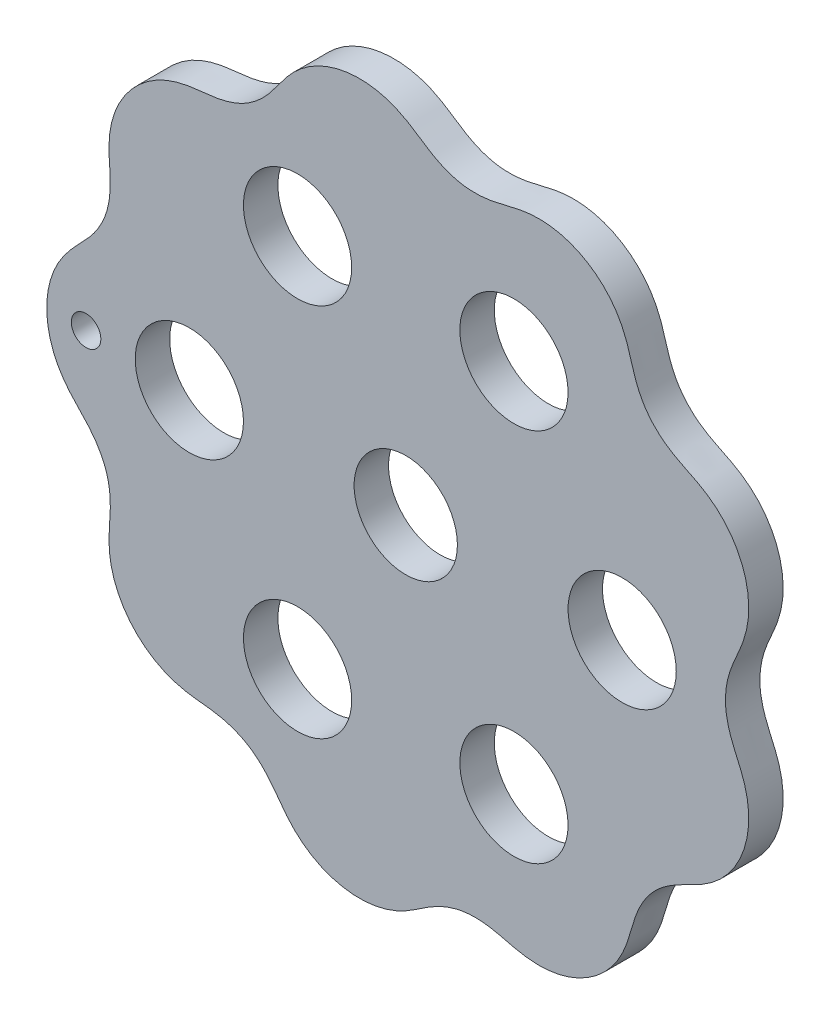
from build123d import *

# Parameters (mm, degrees)
BOSS_EXTRUDE1_DEPTH = 7
SKETCH2_R           = 11
CUT_EXTRUDE1_DEPTH  = 103.897295537
SKETCH3_R           = 10.5
CUT_EXTRUDE2_DEPTH  = 103.897295537
SKETCH4_R           = 3
CUT_EXTRUDE3_DEPTH  = 103.897295537


with BuildPart() as part:
    # Sketch1 → Boss-Extrude1 (new body)
    with BuildSketch(Plane.XY):
        with BuildLine():
            add(Edge.make_bspline(
                [(64.999997419, 0.000806947), (65.00000609, 0.21013312), (65.007534948, 0.64054093), (65.042332664, 1.291380489), (65.135594495, 2.159460023), (65.277248851, 3.032680008), (65.493830203, 4.038569318), (65.809087942, 5.168293211), (66.3609477, 6.758386753), (67.195560637, 8.680353986), (68.186353458, 10.826517495), (69.006376801, 13.131037551), (69.49208346, 15.232893556), (69.778704141, 17.621751772), (69.758565384, 20.283615304), (69.242050418, 23.384282514), (67.989755767, 26.780516545), (66.100351811, 29.905060607), (63.985642903, 32.22443192), (61.963179868, 33.833106887), (59.924357249, 35.117342135), (58.002602637, 36.111433425), (55.773019988, 37.145335072), (53.157717558, 38.627233325), (50.663432719, 40.61244418), (48.177244341, 43.633158774), (46.549449378, 47.248622642), (45.678840997, 50.853036944), (44.487714221, 54.371357413), (42.978225844, 57.263635788), (40.837389165, 60.000224897), (38.049129423, 62.402846227), (34.85625957, 64.226264819), (31.374996628, 65.405595202), (27.906716495, 65.863536097), (24.590928635, 65.686380175), (21.60649148, 65.05079625), (18.916301522, 64.32307683), (15.998824641, 63.774192759), (12.847584732, 63.668028743), (9.728816556, 64.215195529), (6.802016032, 65.388148141), (4.246370247, 66.898838322), (1.967008792, 68.502393598), (-0.618218868, 70.123158088), (-3.671586225, 71.428030238), (-7.086254723, 72.188828978), (-10.76079625, 72.276450148), (-14.385647807, 71.660073729), (-17.829274613, 70.360829533), (-20.779679678, 68.525713643), (-23.190373511, 66.327558714), (-25.516643206, 63.431388327), (-27.565898104, 60.341268628), (-30.327307182, 57.496189029), (-33.693402094, 55.502540068), (-36.714668658, 54.4848558), (-39.309815704, 54.046474509), (-41.383983168, 53.836930402), (-43.161911331, 53.642278824), (-44.638619491, 53.420081839), (-46.62901432, 52.992886762), (-49.081018776, 52.175907503), (-51.863431912, 50.724039888), (-54.737535189, 48.416484059), (-57.117755121, 45.598389652), (-58.915184236, 42.372849822), (-59.987505481, 39.048729025), (-60.406669899, 35.790711752), (-60.325551079, 32.752234211), (-60.072329686, 29.966065889), (-60.013760517, 26.959013226), (-60.450787322, 23.76610463), (-61.549631637, 20.723753194), (-63.253776488, 17.988179386), (-64.989814093, 15.987160092), (-66.447032939, 14.499376804), (-67.657205891, 13.224642472), (-68.599672039, 12.146432903), (-69.536773989, 10.932049653), (-70.432812405, 9.563522537), (-71.249982649, 8.029694321), (-71.950438385, 6.329058177), (-72.480134133, 4.567748418), (-72.835401264, 2.763237252), (-72.969755125, 1.387355273), (-72.999876295, 0.466180194), (-72.999999894, 0.004048412), (-73.000000052, 0.000971906), (-73.000000061, 0.000809922), (-73.000000067, 0.000647937), (-73.000000077, 0.000323969), (-73.000000078, 0), (-73.000000077, -0.000323969), (-73.000000067, -0.000647937), (-73.000000061, -0.000809922), (-73.000000052, -0.000971906), (-72.999999894, -0.004048412), (-72.999876295, -0.466180194), (-72.969755125, -1.387355273), (-72.835401264, -2.763237252), (-72.480134133, -4.567748418), (-71.950438385, -6.329058177), (-71.249982649, -8.029694321), (-70.432812405, -9.563522537), (-69.536773989, -10.932049653), (-68.599672039, -12.146432903), (-67.657205891, -13.224642472), (-66.447032939, -14.499376804), (-64.989814093, -15.987160092), (-63.253776488, -17.988179386), (-61.549631637, -20.723753194), (-60.450787322, -23.76610463), (-60.013760517, -26.959013226), (-60.072329686, -29.966065889), (-60.325551079, -32.752234211), (-60.406669899, -35.790711752), (-59.987505481, -39.048729025), (-58.915184237, -42.372849822), (-57.117755121, -45.598389652), (-54.737535189, -48.416484059), (-51.863431912, -50.724039888), (-49.081018776, -52.175907503), (-46.62901432, -52.992886762), (-44.638619491, -53.420081839), (-43.161911332, -53.642278824), (-41.383983168, -53.836930402), (-39.309815704, -54.046474509), (-36.714668658, -54.4848558), (-33.693402094, -55.502540068), (-30.327307182, -57.496189029), (-27.565898104, -60.341268628), (-25.516643206, -63.431388327), (-23.190373511, -66.327558714), (-20.779679678, -68.525713643), (-17.829274613, -70.360829533), (-14.385647807, -71.660073729), (-10.76079625, -72.276450148), (-7.086254723, -72.188828978), (-3.671586225, -71.428030238), (-0.618218868, -70.123158088), (1.967008792, -68.502393598), (4.246370247, -66.898838322), (6.802016032, -65.388148141), (9.728816556, -64.215195529), (12.847584732, -63.668028743), (15.998824641, -63.774192759), (18.916301522, -64.32307683), (21.60649148, -65.05079625), (24.590928635, -65.686380175), (27.906716495, -65.863536097), (31.374996628, -65.405595202), (34.85625957, -64.226264819), (38.049129423, -62.402846227), (40.837389165, -60.000224897), (42.978225844, -57.263635788), (44.487714221, -54.371357413), (45.678840997, -50.853036944), (46.549449378, -47.248622642), (48.177244341, -43.633158774), (50.663432719, -40.61244418), (53.157717558, -38.627233325), (55.773019988, -37.145335072), (58.002602637, -36.111433425), (59.924357249, -35.117342135), (61.963179868, -33.833106887), (63.985642903, -32.22443192), (66.100351811, -29.905060607), (67.989755767, -26.780516545), (69.242050418, -23.384282514), (69.758565384, -20.283615304), (69.778704141, -17.621751772), (69.49208346, -15.232893556), (69.006376801, -13.131037551), (68.186353458, -10.826517495), (67.195560637, -8.680353986), (66.3609477, -6.758386753), (65.809087942, -5.168293211), (65.493830203, -4.038569318), (65.277248851, -3.032680008), (65.135594495, -2.159460023), (65.042332664, -1.291380489), (65.007534948, -0.64054093), (65.00000609, -0.21013312), (64.999997419, -0.000806947), (64.999997413, -0.000672456), (64.999997409, -0.000537965), (64.999997404, -0.000268982), (64.999997403, 0), (64.999997404, 0.000268982), (64.999997409, 0.000537965), (64.999997413, 0.000672456), (64.999997419, 0.000806947)],
                knots=[0, 0, 0, 0, 0, 0.001798777, 0.003698603, 0.00559843, 0.007498256, 0.009398082, 0.012535417, 0.015672752, 0.021947422, 0.027396838, 0.032846254, 0.036645323, 0.040444391, 0.048041714, 0.055639404, 0.063501433, 0.071363833, 0.079226058, 0.082432391, 0.085638724, 0.092051389, 0.097801992, 0.103552594, 0.111417656, 0.119282983, 0.131114721, 0.137196367, 0.143278014, 0.151140149, 0.159002594, 0.16686461, 0.174705586, 0.182546939, 0.190388196, 0.196737094, 0.203085992, 0.208716671, 0.214347349, 0.222191946, 0.230036411, 0.235667159, 0.241297906, 0.247646828, 0.253995749, 0.261837005, 0.269678347, 0.277519325, 0.285381338, 0.293243791, 0.301105902, 0.307187582, 0.313269263, 0.325100906, 0.332966249, 0.34083107, 0.346581787, 0.352332504, 0.355538846, 0.358745188, 0.36195153, 0.365157871, 0.373020109, 0.380882498, 0.388744531, 0.396634104, 0.404524032, 0.412413638, 0.418564342, 0.424715045, 0.430589756, 0.436464467, 0.444357156, 0.452249357, 0.458124314, 0.463999271, 0.467074598, 0.470149925, 0.473225253, 0.47630058, 0.480245422, 0.484190263, 0.488135211, 0.492080159, 0.49602495, 0.499969741, 0.499996178, 0.499996178, 0.499996178, 0.499996178, 0.49999757, 0.49999757, 0.499998962, 0.499998962, 0.500000354, 0.500000354, 0.500000354, 0.500000354, 0.500026792, 0.503971583, 0.507916373, 0.511861322, 0.51580627, 0.519751111, 0.523695953, 0.52677128, 0.529846607, 0.532921935, 0.535997262, 0.541872219, 0.547747176, 0.555639377, 0.563532065, 0.569406776, 0.575281487, 0.581432191, 0.587582895, 0.595472501, 0.603362429, 0.611252002, 0.619114034, 0.626976424, 0.634838661, 0.638045003, 0.641251345, 0.644457687, 0.647664029, 0.653414746, 0.659165463, 0.667030284, 0.674895627, 0.68672727, 0.69280895, 0.698890631, 0.706752742, 0.714615194, 0.722477207, 0.730318186, 0.738159528, 0.746000784, 0.752349705, 0.758698626, 0.764329374, 0.769960122, 0.777804587, 0.785649184, 0.791279862, 0.796910541, 0.803259439, 0.809608337, 0.817449594, 0.825290947, 0.833131923, 0.840993939, 0.848856384, 0.856718519, 0.862800165, 0.868881812, 0.88071355, 0.888578877, 0.896443939, 0.902194541, 0.907945144, 0.914357809, 0.917564142, 0.920770475, 0.9286327, 0.9364951, 0.944357129, 0.951954819, 0.959552142, 0.96335121, 0.967150279, 0.972599695, 0.978049111, 0.984323781, 0.987461116, 0.990598451, 0.992498277, 0.994398103, 0.99629793, 0.998197756, 0.999996533, 0.999996533, 0.999996533, 0.999996533, 0.999997689, 0.999997689, 0.999998844, 0.999998844, 1, 1, 1, 1, 1], degree=4))
        make_face()
    extrude(amount=BOSS_EXTRUDE1_DEPTH)

    # Sketch2 → Cut-Extrude1 (cut, through all)
    with BuildSketch(Plane.XY.offset(7)):
        with Locations((-44, 0)):
            Circle(SKETCH2_R)
        with Locations((-22, 38.105117767)):
            Circle(SKETCH2_R)
        with Locations((22, 38.105117767)):
            Circle(SKETCH2_R)
        with Locations((44, 0)):
            Circle(SKETCH2_R)
        with Locations((22, -38.105117767)):
            Circle(SKETCH2_R)
        with Locations((-22, -38.105117767)):
            Circle(SKETCH2_R)
    extrude(amount=-CUT_EXTRUDE1_DEPTH, mode=Mode.SUBTRACT)

    # Sketch3 → Cut-Extrude2 (cut, through all)
    with BuildSketch(Plane.XY.offset(7)):
        Circle(SKETCH3_R)
    extrude(amount=-CUT_EXTRUDE2_DEPTH, mode=Mode.SUBTRACT)

    # Sketch4 → Cut-Extrude3 (cut, through all)
    with BuildSketch(Plane.XY.offset(7)):
        with Locations((-65, 0)):
            Circle(SKETCH4_R)
    extrude(amount=-CUT_EXTRUDE3_DEPTH, mode=Mode.SUBTRACT)


solid = part.part
